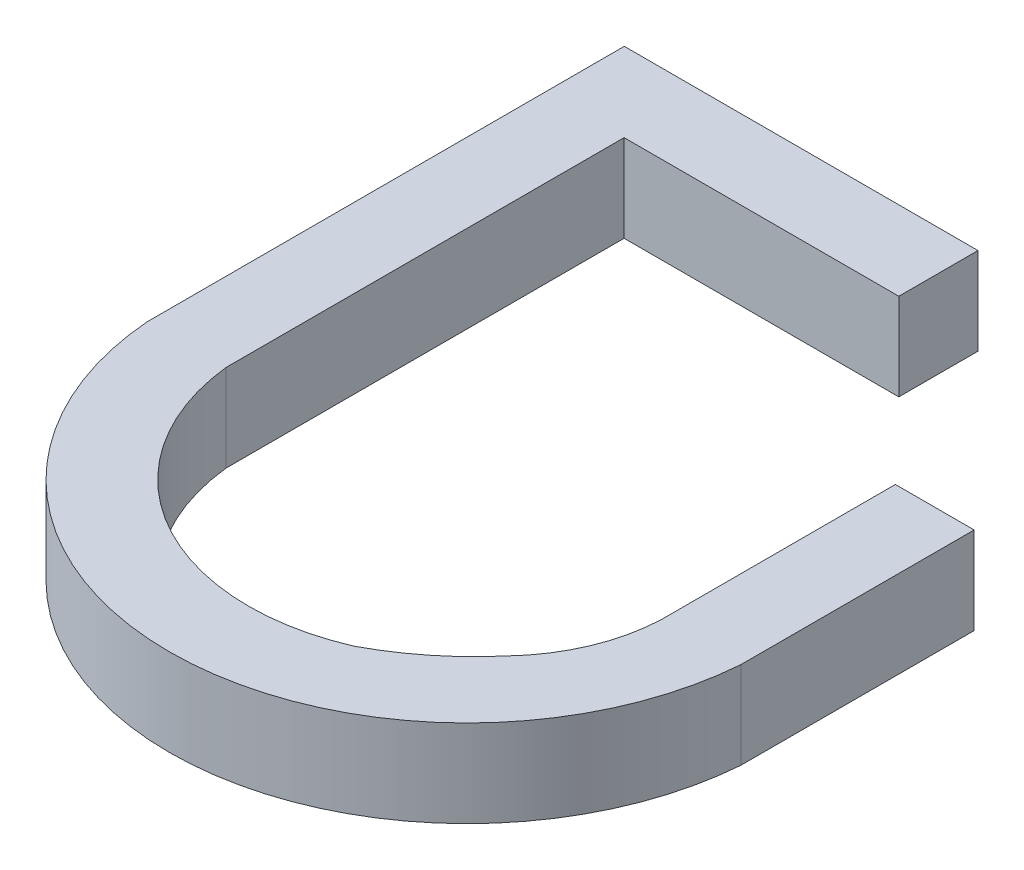
from build123d import *

# Parameters (mm, degrees)
BOSS_EXTRUDE1_DEPTH     = 25.4
BOSS_EXTRUDE1_2_DEPTH   = 25.4
CUT_EXTRUDE1_DEPTH      = 281.867791968
CUT_EXTRUDE1_DEPTH_BACK = 281.867791968
SKETCH2_W               = 46.910236734
SKETCH2_H               = 46.937556504
CUT_EXTRUDE2_DEPTH      = 281.278275978
CUT_EXTRUDE2_DEPTH_BACK = 281.278275978


with BuildPart() as part:
    # Sketch1 → Boss-Extrude1 (new body)
    with BuildSketch(Plane(origin=(0, 0, 0), x_dir=(1, 0, 0), z_dir=(0, 1, 0))):
        with BuildLine():
            Line((0, 80.02759766), (0, 219.067642019))
            Line((0, 219.067642019), (103.040086398, 219.067642019))
            Line((103.040086398, 219.067642019), (103.040086398, 195.999460881))
            Line((103.040086398, 195.999460881), (23.011829096, 195.999460881))
            Line((23.011829096, 195.999460881), (23.011829096, 161.013213822))
            ThreePointArc((23.011829096, 161.013213822), (101.985495584, 126.901824422), (136.744902109, 48.211224327))
            ThreePointArc((136.744902109, 48.211224327), (146.280346481, 62.911008862), (150.026111113, 80.02759766))
            Line((150.026111113, 80.02759766), (150.026111113, 148.011746996))
            Line((150.026111113, 148.011746996), (172.974333949, 148.011746996))
            Line((172.974333949, 148.011746996), (172.974333949, 80.02759766))
            ThreePointArc((172.974333949, 80.02759766), (86.487166974, 0.037389651), (0, 80.02759766))
        make_face()
        with BuildLine():
            Line((23.011829096, 136.058182002), (23.011829096, 80.02759766))
            ThreePointArc((23.011829096, 80.02759766), (54.48283159, 31.69310754), (112.066438029, 28.410547154))
            ThreePointArc((112.066438029, 28.410547154), (90.841729512, 101.512108787), (23.011829096, 136.058182002))
        make_face(mode=Mode.SUBTRACT)
    extrude(amount=BOSS_EXTRUDE1_DEPTH)

    # Sketch3 → Cut-Extrude2 (cut, two sides: drawn at the far end of the back side and taken through both)
    with BuildSketch(Plane(origin=(0, 25.4, 0), x_dir=(1, 0, 0), z_dir=(0, 1, 0)).offset(-CUT_EXTRUDE2_DEPTH_BACK)):
        with BuildLine():
            Line((23.011829096, 161.013213822), (23.011829096, 136.058182002))
            ThreePointArc((23.011829096, 136.058182002), (90.841729512, 101.512108787), (112.066438029, 28.410547154))
            ThreePointArc((112.066438029, 28.410547154), (125.345033885, 37.140114863), (136.744902109, 48.211224327))
            ThreePointArc((136.744902109, 48.211224327), (101.985495584, 126.901824422), (23.011829096, 161.013213822))
        make_face()
    extrude(amount=CUT_EXTRUDE2_DEPTH + CUT_EXTRUDE2_DEPTH_BACK, mode=Mode.SUBTRACT)


with BuildPart() as body_2:
    # Sketch1 → Boss-Extrude1 2 (new body)
    with BuildSketch(Plane(origin=(0, 0, 0), x_dir=(1, 0, 0), z_dir=(0, 1, 0))):
        Polygon((173.927929859, 172.130085515), (150.026111113, 172.130085515), (150.026111113, 195.999460881), (127.017693125, 195.999460881), (127.017693125, 219.067642019), (173.927929859, 219.067642019), align=None)
    extrude(amount=BOSS_EXTRUDE1_2_DEPTH)

    # Sketch2 → Cut-Extrude1 (cut, two sides: drawn at the far end of the back side and taken through both)
    with BuildSketch(Plane(origin=(0, 25.4, 0), x_dir=(1, 0, 0), z_dir=(0, 1, 0)).offset(-CUT_EXTRUDE1_DEPTH_BACK)):
        with Locations((150.472811492, 195.598863767)):
            Rectangle(SKETCH2_W, SKETCH2_H)
    extrude(amount=CUT_EXTRUDE1_DEPTH + CUT_EXTRUDE1_DEPTH_BACK, mode=Mode.SUBTRACT)


solid = part.part
